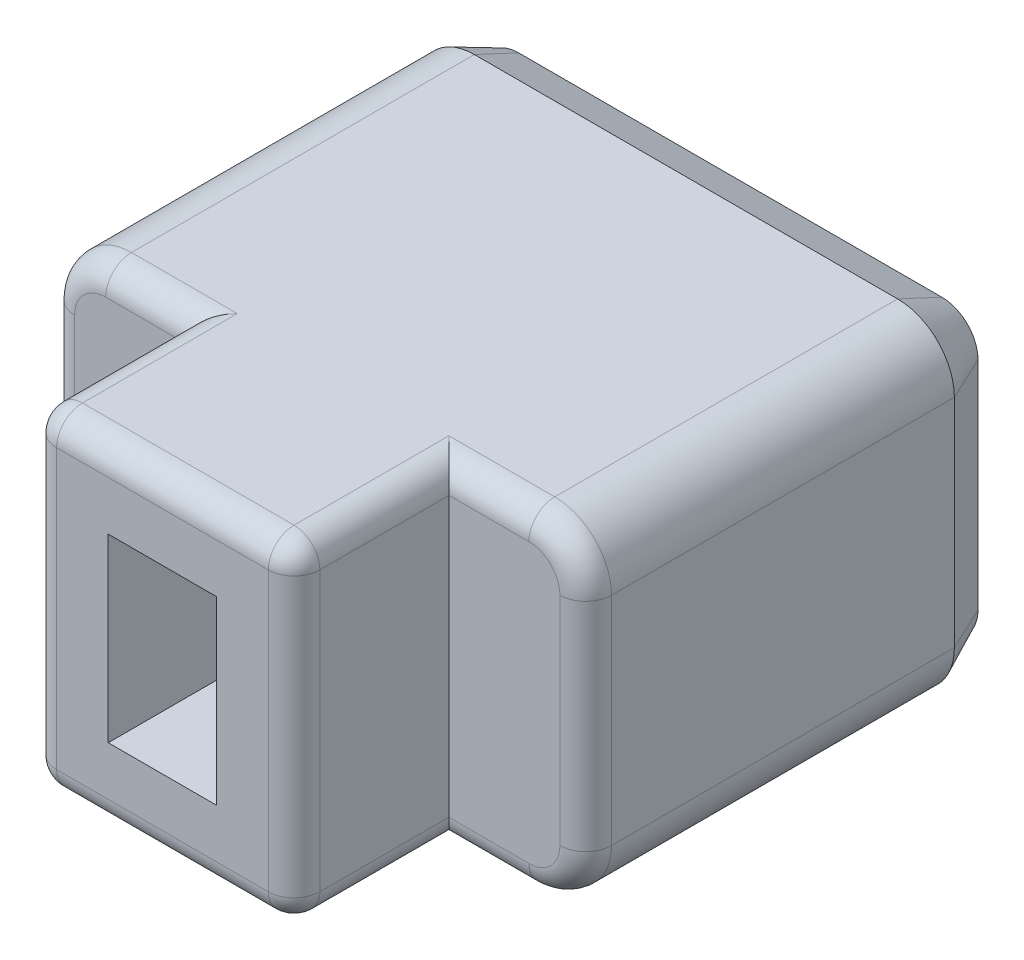
from build123d import *

# Parameters (mm, degrees)
BOSS_EXTRU_1_DEPTH      = 11
ESQUISSE3_W             = 2.1
ESQUISSE3_H             = 3.5
ENL_V_MAT_EXTRU_1_DEPTH = 3
ESQUISSE4_OUTSIDE_W     = 15.688
ESQUISSE4_OUTSIDE_H     = 11.688
ESQUISSE4_OUTSIDE_W_2   = 5.1
ESQUISSE4_OUTSIDE_H_2   = 6.4
ENL_V_MAT_EXTRU_2_DEPTH = 3
CONG_1_R                = 0.5
CHANFREIN1_SIZE         = 0.4
CHANFREIN1_SIZE2        = 0.857802768
ENL_V_MAT_EXTRU_3_DEPTH = 0.3
BOSS_EXTRU_2_DEPTH      = 0.3


with BuildPart() as part:
    # Esquisse2 → Boss.-Extru.1 (new body)
    with BuildSketch(Plane.XY):
        with BuildLine():
            Line((1.1, 0), (9.3, 0))
            ThreePointArc((9.3, 0), (10.077817459, 0.322182541), (10.4, 1.1))
            Line((10.4, 1.1), (10.4, 5.3))
            ThreePointArc((10.4, 5.3), (10.077817459, 6.077817459), (9.3, 6.4))
            Line((9.3, 6.4), (1.1, 6.4))
            ThreePointArc((1.1, 6.4), (0.322182541, 6.077817459), (0, 5.3))
            Line((0, 5.3), (0, 1.1))
            ThreePointArc((0, 1.1), (0.322182541, 0.322182541), (1.1, 0))
        make_face()
    extrude(amount=BOSS_EXTRU_1_DEPTH)

    # Esquisse3 → Enlèv. mat.-Extru.1 (cut)
    with BuildSketch(Plane.XY.offset(11)):
        with Locations((5.2, 3.2)):
            Rectangle(ESQUISSE3_W, ESQUISSE3_H)
    extrude(amount=-ENL_V_MAT_EXTRU_1_DEPTH, mode=Mode.SUBTRACT)

    # Esquisse4 outside → Enlèv. mat.-Extru.2 (cut)
    with BuildSketch(Plane.XY.offset(11)):
        with Locations((5.2, 3.2)):
            Rectangle(ESQUISSE4_OUTSIDE_W, ESQUISSE4_OUTSIDE_H)
        with Locations((5.2, 3.2)):
            Rectangle(ESQUISSE4_OUTSIDE_W_2, ESQUISSE4_OUTSIDE_H_2, mode=Mode.SUBTRACT)
    extrude(amount=-ENL_V_MAT_EXTRU_2_DEPTH, mode=Mode.SUBTRACT)

    # Congé1
    cong_1_edges = [part.edges().sort_by_distance(p)[0] for p in [
        (8.525, 0, 8),
        (10.077817459, 0.322182541, 8),
        (10.4, 3.2, 8),
        (10.077817459, 6.077817459, 8),
        (1.875, 6.4, 8),
        (0.322182541, 6.077817459, 8),
        (1.875, 0, 8),
        (0.322182541, 0.322182541, 8),
        (7.75, 6.4, 9.5),
        (2.65, 6.4, 9.5),
        (7.75, 0, 9.5),
        (2.65, 0, 9.5),
        (2.65, 3.2, 11),
        (5.2, 6.4, 11),
        (7.75, 3.2, 11),
        (5.2, 0, 11),
        (8.525, 6.4, 8),
        (0, 3.2, 8),
    ]]
    fillet(cong_1_edges, radius=CONG_1_R)

    # Chanfrein1
    chanfrein1_edges = [part.edges().sort_by_distance(p)[0] for p in [
        (5.2, 0, 0),
        (10.077817459, 0.322182541, 0),
        (0.322182541, 0.322182541, 0),
        (10.4, 3.2, 0),
        (0, 3.2, 0),
        (10.077817459, 6.077817459, 0),
        (0.322182541, 6.077817459, 0),
        (5.2, 6.4, 0),
    ]]
    chanfrein1_side = [part.faces().sort_by_distance(p)[0] for p in [
        (5.2, 3.2, 0),
    ]]
    chamfer(chanfrein1_edges, length=CHANFREIN1_SIZE, length2=CHANFREIN1_SIZE2, reference=chanfrein1_side[0])

    # Esquisse5 → Enlèv. mat.-Extru.3 (cut)
    with BuildSketch(Plane(origin=(0, 0, 0), x_dir=(-1, 0, 0), z_dir=(0, 0, -1))):
        with BuildLine():
            Line((-6.276923077, 1.3), (-6.276923077, 1.71025641))
            Line((-6.276923077, 1.71025641), (-5.082211538, 1.71025641))
            Line((-5.082211538, 1.71025641), (-4.892307692, 2.76875))
            add(Edge.make_bspline(
                [(-4.892307692, 2.76875), (-4.928720292, 2.75589485), (-4.998926765, 2.731109069), (-5.103384586, 2.704429713), (-5.202452531, 2.6885596), (-5.266722635, 2.685899738), (-5.29775641, 2.684615385)],
                knots=[0, 0, 0, 0, 1.113143318, 2.146231409, 3.104880253, 4, 4, 4, 4], degree=3))
            add(Edge.make_bspline(
                [(-5.29775641, 2.684615385), (-5.336299935, 2.68554409), (-5.411939336, 2.68736662), (-5.522173546, 2.706100802), (-5.627980502, 2.733508565), (-5.727810071, 2.775116846), (-5.823512365, 2.826278558), (-5.912783181, 2.890552636), (-5.997188953, 2.965581967), (-6.076381585, 3.050784094), (-6.1469281, 3.146137406), (-6.209879716, 3.247661883), (-6.262049523, 3.356392925), (-6.305730332, 3.470924468), (-6.338034489, 3.592734438), (-6.362205718, 3.720426219), (-6.376854914, 3.854680932), (-6.378597675, 3.94633088), (-6.379487179, 3.993108974)],
                knots=[0, 0, 0, 0, 0.973361819, 1.910165304, 2.819111759, 3.730587208, 4.636897028, 5.556735726, 6.503726233, 7.487915806, 8.491187352, 9.497430418, 10.502948427, 11.534954338, 12.591340586, 13.683767542, 14.817795931, 16, 16, 16, 16], degree=3))
            add(Edge.make_bspline(
                [(-6.379487179, 3.993108974), (-6.377396002, 4.057851586), (-6.373277648, 4.185355382), (-6.343370024, 4.372425727), (-6.292294817, 4.550710257), (-6.234205526, 4.692032529), (-6.178821606, 4.799052367), (-6.132833881, 4.874664501), (-6.083556369, 4.945768459), (-6.030349481, 5.011739172), (-5.974174284, 5.072807425), (-5.91468235, 5.129282045), (-5.85121832, 5.180781369), (-5.783879054, 5.226752576), (-5.714374172, 5.269189987), (-5.640899854, 5.303869168), (-5.565446494, 5.334909533), (-5.487076733, 5.359337493), (-5.406287724, 5.379000454), (-5.322909035, 5.392030445), (-5.236817258, 5.401707386), (-5.178394098, 5.402275518), (-5.148717949, 5.402564103)],
                knots=[0, 0, 0, 0, 1.85419403, 3.651641001, 5.409856766, 7.156045833, 8.018397344, 8.859477552, 9.689347527, 10.494696235, 11.285226259, 12.064570028, 12.842447769, 13.623442215, 14.39890816, 15.172257613, 15.947987714, 16.734397369, 17.521216312, 18.327473069, 19.150436932, 20, 20, 20, 20], degree=3))
            add(Edge.make_bspline(
                [(-5.148717949, 5.402564103), (-5.113667483, 5.401742682), (-5.044294606, 5.400116904), (-4.942922056, 5.38416141), (-4.845315537, 5.360282302), (-4.752075753, 5.32598562), (-4.663695346, 5.279972471), (-4.578043383, 5.227077646), (-4.498644162, 5.16142768), (-4.422583356, 5.088651374), (-4.353939814, 5.006582275), (-4.289420499, 4.920456466), (-4.235387766, 4.826209669), (-4.187027705, 4.727399895), (-4.147201231, 4.6220325), (-4.112989183, 4.511774766), (-4.088648221, 4.394921946), (-4.077479879, 4.315027532), (-4.071794872, 4.274358974)],
                knots=[0, 0, 0, 0, 0.980031455, 1.939706048, 2.864104874, 3.788654732, 4.711118148, 5.648267904, 6.599495805, 7.587812561, 8.589711592, 9.589713508, 10.594590454, 11.624065929, 12.664979174, 13.74300419, 14.851124159, 16, 16, 16, 16], degree=3))
            Line((-4.071794872, 4.274358974), (-4.430769231, 4.274358974))
            add(Edge.make_bspline(
                [(-4.430769231, 4.274358974), (-4.438023063, 4.312473073), (-4.451916917, 4.385476096), (-4.484032597, 4.487894408), (-4.520455587, 4.580133941), (-4.56760955, 4.660660993), (-4.620508348, 4.732956481), (-4.6825436, 4.796945505), (-4.752117007, 4.853818108), (-4.829012716, 4.902295117), (-4.910146488, 4.942535476), (-4.994870264, 4.971742138), (-5.082040021, 4.989033725), (-5.140897254, 4.99121571), (-5.170352564, 4.992307692)],
                knots=[0, 0, 0, 0, 1.237967357, 2.371179253, 3.422976385, 4.397391531, 5.342507057, 6.27756129, 7.235408665, 8.205595907, 9.17454497, 10.1213526, 11.05982427, 12, 12, 12, 12], degree=3))
            add(Edge.make_bspline(
                [(-5.170352564, 4.992307692), (-5.198989401, 4.991361498), (-5.25552166, 4.989493607), (-5.338796003, 4.975268277), (-5.418995243, 4.953132569), (-5.496161299, 4.921338401), (-5.570227491, 4.880369226), (-5.640505981, 4.829294002), (-5.708612888, 4.770547688), (-5.771726835, 4.702753351), (-5.830233393, 4.628888843), (-5.880776611, 4.548905089), (-5.924181533, 4.464800526), (-5.959675799, 4.376016122), (-5.986887097, 4.282875142), (-6.005817424, 4.185214632), (-6.018388853, 4.083178649), (-6.019795469, 4.013446763), (-6.020512821, 3.977884615)],
                knots=[0, 0, 0, 0, 0.933486303, 1.842804437, 2.747354045, 3.641866381, 4.558125182, 5.500831726, 6.470203692, 7.486945556, 8.516774202, 9.538911934, 10.567376691, 11.599339699, 12.652264323, 13.726765685, 14.840686828, 16, 16, 16, 16], degree=3))
            add(Edge.make_bspline(
                [(-6.020512821, 3.977884615), (-6.020105804, 3.945788306), (-6.019312796, 3.883253796), (-6.007031102, 3.791750266), (-5.990354728, 3.704635478), (-5.964707903, 3.622333435), (-5.934381496, 3.544053012), (-5.893756644, 3.471654038), (-5.848873669, 3.402398549), (-5.795468738, 3.339074136), (-5.736750533, 3.281845615), (-5.672959079, 3.231193279), (-5.603586791, 3.189905543), (-5.529955198, 3.154842154), (-5.45147742, 3.12777018), (-5.368245654, 3.108469951), (-5.280434955, 3.097258977), (-5.220331398, 3.095679719), (-5.189583333, 3.094871795)],
                knots=[0, 0, 0, 0, 1.127264374, 2.19629379, 3.240293685, 4.241187752, 5.222740122, 6.18483682, 7.153507664, 8.119992094, 9.08934518, 10.032192447, 10.975740628, 11.920689079, 12.894578236, 13.887514539, 14.919284615, 16, 16, 16, 16], degree=3))
            add(Edge.make_bspline(
                [(-5.189583333, 3.094871795), (-5.162848934, 3.095536279), (-5.107617846, 3.096909048), (-5.02301382, 3.106992053), (-4.934230539, 3.123278248), (-4.841423038, 3.145811632), (-4.744376138, 3.174795596), (-4.643191704, 3.210453666), (-4.537683528, 3.251703558), (-4.466957039, 3.283652866), (-4.430769231, 3.3)],
                knots=[0, 0, 0, 0, 0.810269167, 1.673950008, 2.579134618, 3.545268136, 4.567349434, 5.647883586, 6.7965197, 8, 8, 8, 8], degree=3))
            Line((-4.430769231, 3.3), (-4.78974359, 1.3))
            Line((-4.78974359, 1.3), (-6.276923077, 1.3))
        make_face()
    extrude(amount=-ENL_V_MAT_EXTRU_3_DEPTH, mode=Mode.SUBTRACT)


with BuildPart() as body_2:
    # Esquisse5<2> → Boss.-Extru.2 (new body)
    with BuildSketch(Plane(origin=(0, 0, 0), x_dir=(-1, 0, 0), z_dir=(0, 0, -1))):
        with BuildLine():
            Line((-6.276923077, 1.3), (-6.276923077, 1.71025641))
            Line((-6.276923077, 1.71025641), (-5.082211538, 1.71025641))
            Line((-5.082211538, 1.71025641), (-4.892307692, 2.76875))
            add(Edge.make_bspline(
                [(-4.892307692, 2.76875), (-4.928720292, 2.75589485), (-4.998926765, 2.731109069), (-5.103384586, 2.704429713), (-5.202452531, 2.6885596), (-5.266722635, 2.685899738), (-5.29775641, 2.684615385)],
                knots=[0, 0, 0, 0, 1.113143318, 2.146231409, 3.104880253, 4, 4, 4, 4], degree=3))
            add(Edge.make_bspline(
                [(-5.29775641, 2.684615385), (-5.336299935, 2.68554409), (-5.411939336, 2.68736662), (-5.522173546, 2.706100802), (-5.627980502, 2.733508565), (-5.727810071, 2.775116846), (-5.823512365, 2.826278558), (-5.912783181, 2.890552636), (-5.997188953, 2.965581967), (-6.076381585, 3.050784094), (-6.1469281, 3.146137406), (-6.209879716, 3.247661883), (-6.262049523, 3.356392925), (-6.305730332, 3.470924468), (-6.338034489, 3.592734438), (-6.362205718, 3.720426219), (-6.376854914, 3.854680932), (-6.378597675, 3.94633088), (-6.379487179, 3.993108974)],
                knots=[0, 0, 0, 0, 0.973361819, 1.910165304, 2.819111759, 3.730587208, 4.636897028, 5.556735726, 6.503726233, 7.487915806, 8.491187352, 9.497430418, 10.502948427, 11.534954338, 12.591340586, 13.683767542, 14.817795931, 16, 16, 16, 16], degree=3))
            add(Edge.make_bspline(
                [(-6.379487179, 3.993108974), (-6.377396002, 4.057851586), (-6.373277648, 4.185355382), (-6.343370024, 4.372425727), (-6.292294817, 4.550710257), (-6.234205526, 4.692032529), (-6.178821606, 4.799052367), (-6.132833881, 4.874664501), (-6.083556369, 4.945768459), (-6.030349481, 5.011739172), (-5.974174284, 5.072807425), (-5.91468235, 5.129282045), (-5.85121832, 5.180781369), (-5.783879054, 5.226752576), (-5.714374172, 5.269189987), (-5.640899854, 5.303869168), (-5.565446494, 5.334909533), (-5.487076733, 5.359337493), (-5.406287724, 5.379000454), (-5.322909035, 5.392030445), (-5.236817258, 5.401707386), (-5.178394098, 5.402275518), (-5.148717949, 5.402564103)],
                knots=[0, 0, 0, 0, 1.85419403, 3.651641001, 5.409856766, 7.156045833, 8.018397344, 8.859477552, 9.689347527, 10.494696235, 11.285226259, 12.064570028, 12.842447769, 13.623442215, 14.39890816, 15.172257613, 15.947987714, 16.734397369, 17.521216312, 18.327473069, 19.150436932, 20, 20, 20, 20], degree=3))
            add(Edge.make_bspline(
                [(-5.148717949, 5.402564103), (-5.113667483, 5.401742682), (-5.044294606, 5.400116904), (-4.942922056, 5.38416141), (-4.845315537, 5.360282302), (-4.752075753, 5.32598562), (-4.663695346, 5.279972471), (-4.578043383, 5.227077646), (-4.498644162, 5.16142768), (-4.422583356, 5.088651374), (-4.353939814, 5.006582275), (-4.289420499, 4.920456466), (-4.235387766, 4.826209669), (-4.187027705, 4.727399895), (-4.147201231, 4.6220325), (-4.112989183, 4.511774766), (-4.088648221, 4.394921946), (-4.077479879, 4.315027532), (-4.071794872, 4.274358974)],
                knots=[0, 0, 0, 0, 0.980031455, 1.939706048, 2.864104874, 3.788654732, 4.711118148, 5.648267904, 6.599495805, 7.587812561, 8.589711592, 9.589713508, 10.594590454, 11.624065929, 12.664979174, 13.74300419, 14.851124159, 16, 16, 16, 16], degree=3))
            Line((-4.071794872, 4.274358974), (-4.430769231, 4.274358974))
            add(Edge.make_bspline(
                [(-4.430769231, 4.274358974), (-4.438023063, 4.312473073), (-4.451916917, 4.385476096), (-4.484032597, 4.487894408), (-4.520455587, 4.580133941), (-4.56760955, 4.660660993), (-4.620508348, 4.732956481), (-4.6825436, 4.796945505), (-4.752117007, 4.853818108), (-4.829012716, 4.902295117), (-4.910146488, 4.942535476), (-4.994870264, 4.971742138), (-5.082040021, 4.989033725), (-5.140897254, 4.99121571), (-5.170352564, 4.992307692)],
                knots=[0, 0, 0, 0, 1.237967357, 2.371179253, 3.422976385, 4.397391531, 5.342507057, 6.27756129, 7.235408665, 8.205595907, 9.17454497, 10.1213526, 11.05982427, 12, 12, 12, 12], degree=3))
            add(Edge.make_bspline(
                [(-5.170352564, 4.992307692), (-5.198989401, 4.991361498), (-5.25552166, 4.989493607), (-5.338796003, 4.975268277), (-5.418995243, 4.953132569), (-5.496161299, 4.921338401), (-5.570227491, 4.880369226), (-5.640505981, 4.829294002), (-5.708612888, 4.770547688), (-5.771726835, 4.702753351), (-5.830233393, 4.628888843), (-5.880776611, 4.548905089), (-5.924181533, 4.464800526), (-5.959675799, 4.376016122), (-5.986887097, 4.282875142), (-6.005817424, 4.185214632), (-6.018388853, 4.083178649), (-6.019795469, 4.013446763), (-6.020512821, 3.977884615)],
                knots=[0, 0, 0, 0, 0.933486303, 1.842804437, 2.747354045, 3.641866381, 4.558125182, 5.500831726, 6.470203692, 7.486945556, 8.516774202, 9.538911934, 10.567376691, 11.599339699, 12.652264323, 13.726765685, 14.840686828, 16, 16, 16, 16], degree=3))
            add(Edge.make_bspline(
                [(-6.020512821, 3.977884615), (-6.020105804, 3.945788306), (-6.019312796, 3.883253796), (-6.007031102, 3.791750266), (-5.990354728, 3.704635478), (-5.964707903, 3.622333435), (-5.934381496, 3.544053012), (-5.893756644, 3.471654038), (-5.848873669, 3.402398549), (-5.795468738, 3.339074136), (-5.736750533, 3.281845615), (-5.672959079, 3.231193279), (-5.603586791, 3.189905543), (-5.529955198, 3.154842154), (-5.45147742, 3.12777018), (-5.368245654, 3.108469951), (-5.280434955, 3.097258977), (-5.220331398, 3.095679719), (-5.189583333, 3.094871795)],
                knots=[0, 0, 0, 0, 1.127264374, 2.19629379, 3.240293685, 4.241187752, 5.222740122, 6.18483682, 7.153507664, 8.119992094, 9.08934518, 10.032192447, 10.975740628, 11.920689079, 12.894578236, 13.887514539, 14.919284615, 16, 16, 16, 16], degree=3))
            add(Edge.make_bspline(
                [(-5.189583333, 3.094871795), (-5.162848934, 3.095536279), (-5.107617846, 3.096909048), (-5.02301382, 3.106992053), (-4.934230539, 3.123278248), (-4.841423038, 3.145811632), (-4.744376138, 3.174795596), (-4.643191704, 3.210453666), (-4.537683528, 3.251703558), (-4.466957039, 3.283652866), (-4.430769231, 3.3)],
                knots=[0, 0, 0, 0, 0.810269167, 1.673950008, 2.579134618, 3.545268136, 4.567349434, 5.647883586, 6.7965197, 8, 8, 8, 8], degree=3))
            Line((-4.430769231, 3.3), (-4.78974359, 1.3))
            Line((-4.78974359, 1.3), (-6.276923077, 1.3))
        make_face()
    extrude(amount=BOSS_EXTRU_2_DEPTH)


solid = Compound([part.part, body_2.part])
